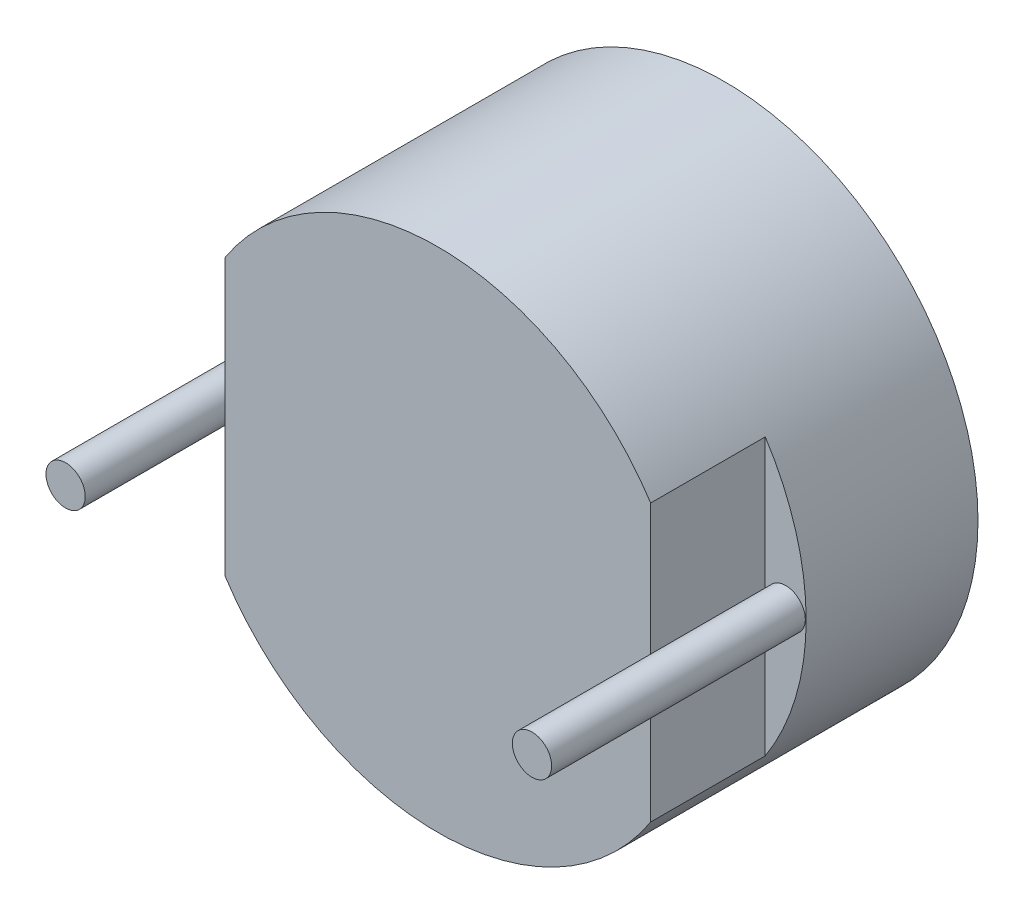
from build123d import *

# Parameters (mm, degrees)
SKETCH1_R            = 3.1
BOSS_EXTRUDE1_DEPTH  = 3.5
CUT_EXTRUDE1_START   = -1.4
CUT_EXTRUDE1_DEPTH   = 1.4
SKETCH4_R            = 0.24
BOSS_EXTRUDE23_DEPTH = 3.1
SKETCH5_R            = 0.24
BOSS_EXTRUDE24_DEPTH = 3.1
SKETCH6_R            = 2.9
CUT_EXTRUDE3_DEPTH   = 0.2
SKETCH7_R            = 1.675
BOSS_EXTRUDE25_DEPTH = 1


with BuildPart() as part:
    # Sketch1 → Boss-Extrude1 (new body)
    with BuildSketch(Plane.XY):
        with Locations((-49.1532488, 27.163637495)):
            Circle(SKETCH1_R)
    extrude(amount=BOSS_EXTRUDE1_DEPTH)

    # Sketch2 → Cut-Extrude1 (cut)
    with BuildSketch(Plane.XY.offset(3.5).offset(CUT_EXTRUDE1_START)):
        with BuildLine():
            Line((-51.7532488, 27.163637495), (-51.7532488, 28.851831796))
            ThreePointArc((-51.7532488, 28.851831796), (-52.2532488, 27.163637495), (-51.7532488, 25.475443193))
            Line((-51.7532488, 25.475443193), (-51.7532488, 27.163637495))
        make_face()
        with BuildLine():
            Line((-46.5532488, 27.163637495), (-46.5532488, 25.475443193))
            ThreePointArc((-46.5532488, 25.475443193), (-46.0532488, 27.163637495), (-46.5532488, 28.851831796))
            Line((-46.5532488, 28.851831796), (-46.5532488, 27.163637495))
        make_face()
    extrude(amount=CUT_EXTRUDE1_DEPTH, mode=Mode.SUBTRACT)

    # Sketch4 → Boss-Extrude23 (add)
    with BuildSketch(Plane.XY.offset(2.1)):
        with Locations((-46.3032488, 27.163637495)):
            Circle(SKETCH4_R)
    extrude(amount=BOSS_EXTRUDE23_DEPTH)

    # Sketch5 → Boss-Extrude24 (add)
    with BuildSketch(Plane.XY.offset(2.1)):
        with Locations((-52.0032488, 27.163637495)):
            Circle(SKETCH5_R)
    extrude(amount=BOSS_EXTRUDE24_DEPTH)

    # Sketch6 → Cut-Extrude3 (cut)
    with BuildSketch(Plane(origin=(0, 0, 0), x_dir=(-1, 0, 0), z_dir=(0, 0, -1))):
        with Locations((49.1532488, 27.163637495)):
            Circle(SKETCH6_R)
    extrude(amount=-CUT_EXTRUDE3_DEPTH, mode=Mode.SUBTRACT)

    # Sketch7 → Boss-Extrude25 (add)
    with BuildSketch(Plane(origin=(0, 0, 0.2), x_dir=(-1, 0, 0), z_dir=(0, 0, -1))):
        with Locations((49.1532488, 27.163637495)):
            Circle(SKETCH7_R)
    extrude(amount=BOSS_EXTRUDE25_DEPTH)


solid = part.part
